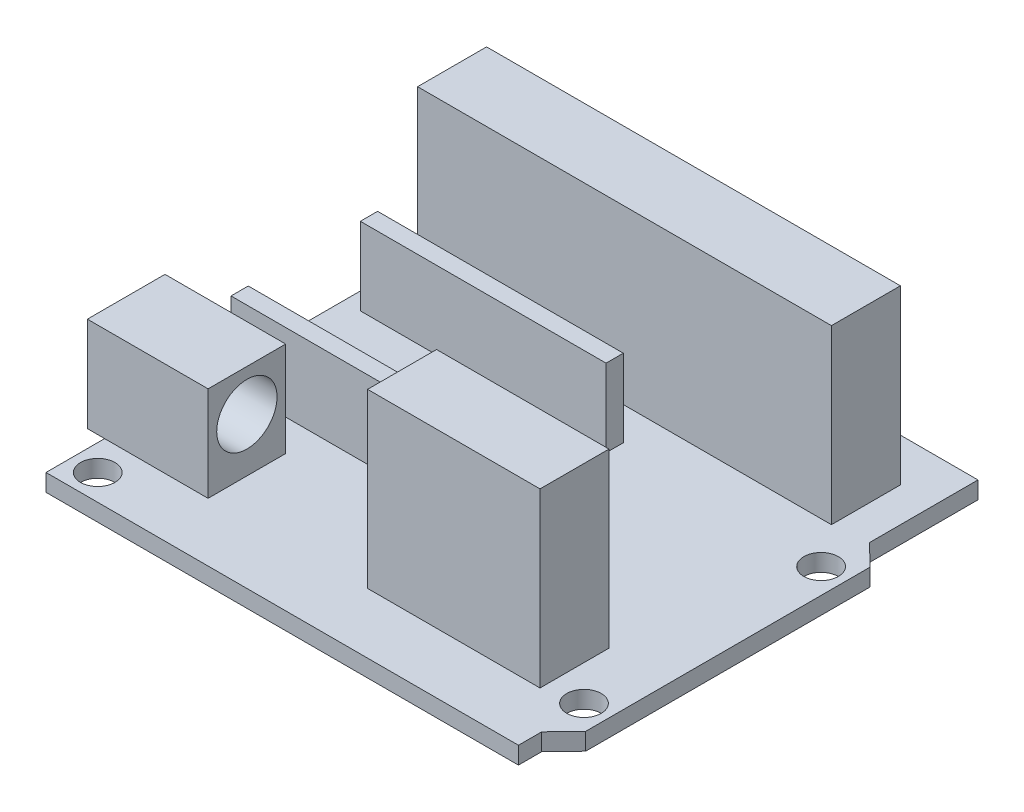
from build123d import *

# Parameters (mm, degrees)
SKETCH1_R           = 2
BOSS_EXTRUDE1_DEPTH = 2
SKETCH2_W           = 28.5
SKETCH2_H           = 2
BOSS_EXTRUDE2_DEPTH = 9
LPATTERN1_COUNT     = 2
LPATTERN1_PITCH     = 15
SKETCH3_W           = 20
SKETCH3_H           = 8
BOSS_EXTRUDE3_DEPTH = 20
SKETCH4_W           = 48
SKETCH4_H           = 8
BOSS_EXTRUDE4_DEPTH = 20
SKETCH5_W           = 9
SKETCH5_H           = 11
SKETCH5_R           = 3.5
BOSS_EXTRUDE5_DEPTH = 14


with BuildPart() as part:
    # Sketch1 → Boss-Extrude1 (new body)
    with BuildSketch(Plane(origin=(0, 0, 0), x_dir=(1, 0, 0), z_dir=(0, 1, 0))):
        Polygon((54.8, 40.7), (54.8, 53.3), (0, 53.3), (0, 0), (54.8, 0), (54.8, 2.695833333), (57.3, 5.3), (57.3, 38.3), align=None)
        with Locations(Location((3, 3, 0), (0, 0, 270))):
            Circle(SKETCH1_R, mode=Mode.SUBTRACT)
        with Locations(Location((54.4, 8, 0), (0, 0, 270))):
            Circle(SKETCH1_R, mode=Mode.SUBTRACT)
        with Locations(Location((4, 50.8, 0), (0, 0, 270))):
            Circle(SKETCH1_R, mode=Mode.SUBTRACT)
        with Locations(Location((54.4, 35.5, 0), (0, 0, 270))):
            Circle(SKETCH1_R, mode=Mode.SUBTRACT)
    extrude(amount=BOSS_EXTRUDE1_DEPTH)

    # Sketch2 → Boss-Extrude2 (add)
    with BuildSketch(Plane(origin=(0, 2, 0), x_dir=(1, 0, 0), z_dir=(0, 1, 0))):
        with Locations((16.25, 35.460185898)):
            Rectangle(SKETCH2_W, SKETCH2_H)
    boss_extrude2 = extrude(amount=BOSS_EXTRUDE2_DEPTH)

    # LPattern1: Boss-Extrude2 ×2
    with Locations(*[(0, 0, i * LPATTERN1_PITCH) for i in range(1, LPATTERN1_COUNT)]):
        add(boss_extrude2)

    # Sketch3 → Boss-Extrude3 (add)
    with BuildSketch(Plane(origin=(0, 2, 0), x_dir=(1, 0, 0), z_dir=(0, 1, 0))):
        with Locations((40.3, 11)):
            Rectangle(SKETCH3_W, SKETCH3_H)
    extrude(amount=BOSS_EXTRUDE3_DEPTH)

    # Sketch4 → Boss-Extrude4 (add)
    with BuildSketch(Plane(origin=(0, 2, 0), x_dir=(1, 0, 0), z_dir=(0, 1, 0))):
        with Locations((26.8, 44.3)):
            Rectangle(SKETCH4_W, SKETCH4_H)
    extrude(amount=BOSS_EXTRUDE4_DEPTH)

    # Sketch5 → Boss-Extrude5 (add)
    with BuildSketch(Plane.ZY.offset(2)):
        with Locations((-11.3, 7.5)):
            Rectangle(SKETCH5_W, SKETCH5_H)
        with Locations((-11.3, 8.2)):
            Circle(SKETCH5_R, mode=Mode.SUBTRACT)
    extrude(amount=-BOSS_EXTRUDE5_DEPTH)


solid = part.part
